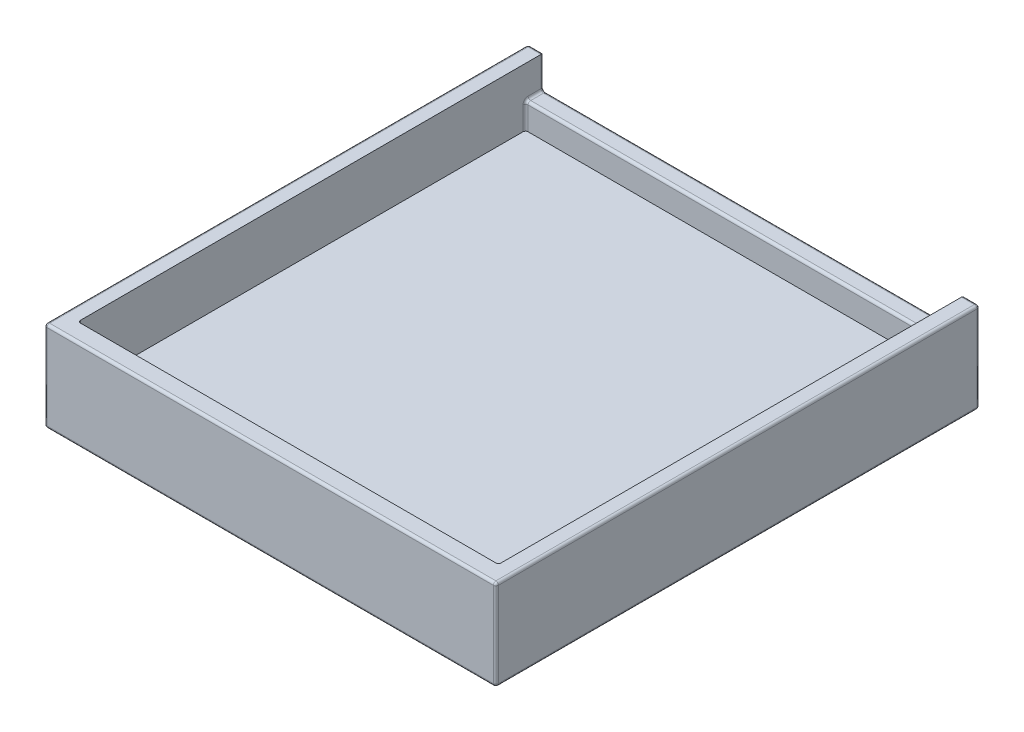
from build123d import *

# Parameters (mm, degrees)
SKETCH1_W           = 70
SKETCH1_H           = 75
BOSS_EXTRUDE1_DEPTH = 9
SKETCH2_W           = 65.2
SKETCH2_H           = 69.4
CUT_EXTRUDE1_DEPTH  = 4
SKETCH4_R           = 2.5
BOSS_EXTRUDE3_DEPTH = 7.5
BOSS_EXTRUDE4_DEPTH = 5
FILLET1_R           = 0.4


with BuildPart() as part:
    # Sketch1 → Boss-Extrude1 (new body)
    with BuildSketch(Plane(origin=(0, 0, 0), x_dir=(1, 0, 0), z_dir=(0, 1, 0))):
        with Locations((35, 37.5)):
            Rectangle(SKETCH1_W, SKETCH1_H)
    extrude(amount=BOSS_EXTRUDE1_DEPTH)

    # Sketch2 → Cut-Extrude1 (cut)
    with BuildSketch(Plane(origin=(0, 9, 0), x_dir=(1, 0, 0), z_dir=(0, 1, 0))):
        with Locations((35, 37.5)):
            Rectangle(SKETCH2_W, SKETCH2_H)
    extrude(amount=-CUT_EXTRUDE1_DEPTH, mode=Mode.SUBTRACT)

    # Sketch4 → Boss-Extrude3 (add)
    with BuildSketch(Plane.XZ):
        with Locations(Location((17.5, -54, 0), (0, 0, 270))):
            Circle(SKETCH4_R)
        with Locations(Location((52.5, -54, 0), (0, 0, 90))):
            Circle(SKETCH4_R)
    extrude(amount=BOSS_EXTRUDE3_DEPTH)

    # Sketch5 → Boss-Extrude4 (add)
    with BuildSketch(Plane(origin=(0, 9, 0), x_dir=(1, 0, 0), z_dir=(0, 1, 0))):
        Polygon((2.4, 75), (0, 75), (0, 0), (70, 0), (70, 75), (67.6, 75), (67.6, 2.8), (2.4, 2.8), align=None)
    extrude(amount=BOSS_EXTRUDE4_DEPTH)

    # Fillet1
    fillet1_edges = [part.edges().sort_by_distance(p)[0] for p in [
        (35, 9, -72.2),
        (2.4, 7, -72.2),
        (2.4, 9.5, -2.8),
        (67.6, 9.5, -2.8),
        (67.6, 7, -72.2),
        (17.5, 0, -51.5),
        (17.5, -7.5, -51.5),
        (52.5, 0, -56.5),
        (52.5, -7.5, -56.5),
        (35, 9, -75),
        (2.4, 9, -73.6),
        (67.6, 9, -73.6),
        (35, 14, 0),
        (70, 14, -37.5),
        (68.8, 14, -75),
        (1.2, 14, -75),
        (0, 14, -37.5),
        (2.4, 11.5, -75),
        (67.6, 11.5, -75),
        (35, 0, -75),
        (70, 0, -37.5),
        (35, 0, 0),
        (0, 0, -37.5),
        (0, 7, -75),
        (70, 7, -75),
        (70, 7, 0),
        (0, 7, 0),
    ]]
    fillet(fillet1_edges, radius=FILLET1_R)


solid = part.part
